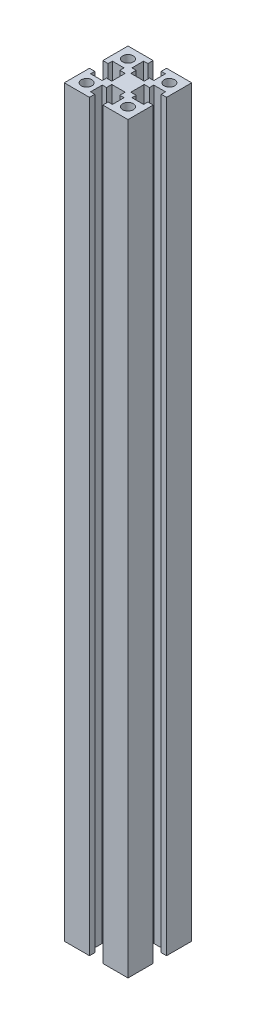
from build123d import *

# Parameters (mm, degrees)
SKETCH_1_R          = 2.5
EXTRUDE_1_DEPTH     = 180
SKETCH_2_R          = 82.250528809
CUT_EXTRUDE_1_DEPTH = 10


with BuildPart() as part:
    # 草图1 → 凸台-拉伸1 (new, symmetric)
    with BuildSketch(Plane(origin=(0, 0, 0), x_dir=(1, 0, 0), z_dir=(0, 1, 0))):
        Polygon((-15, -3.15), (-12.5, -3.15), (-12.5, -5.15), (-7, -5.15), (-7, -3.15), (-4.5, -3.15), (-4.5, 3.15), (-7, 3.15), (-7, 5.15), (-12.5, 5.15), (-12.5, 3.15), (-15, 3.15), (-15, 15), (-3.15, 15), (-3.15, 12.5), (-5.15, 12.5), (-5.15, 7), (-3.15, 7), (-3.15, 4.5), (3.15, 4.5), (3.15, 7), (5.15, 7), (5.15, 12.5), (3.15, 12.5), (3.15, 15), (15, 15), (15, 3.15), (12.5, 3.15), (12.5, 5.15), (7, 5.15), (7, 3.15), (4.5, 3.15), (4.5, -3.15), (7, -3.15), (7, -5.15), (12.5, -5.15), (12.5, -3.15), (15, -3.15), (15, -15), (3.15, -15), (3.15, -12.5), (5.15, -12.5), (5.15, -7), (3.15, -7), (3.15, -4.5), (-3.15, -4.5), (-3.15, -7), (-5.15, -7), (-5.15, -12.5), (-3.15, -12.5), (-3.15, -15), (-15, -15), align=None)
        with Locations(Location((-9.75, -9.75, 0), (0, 0, 90))):
            Circle(SKETCH_1_R, mode=Mode.SUBTRACT)
        with Locations(Location((-9.75, 9.75, 0), (0, 0, 90))):
            Circle(SKETCH_1_R, mode=Mode.SUBTRACT)
        with Locations(Location((9.75, 9.75, 0), (0, 0, 90))):
            Circle(SKETCH_1_R, mode=Mode.SUBTRACT)
        with Locations(Location((9.75, -9.75, 0), (0, 0, 90))):
            Circle(SKETCH_1_R, mode=Mode.SUBTRACT)
    extrude(amount=EXTRUDE_1_DEPTH, both=True)

    # 草图2 → 切除-拉伸1 (cut)
    with BuildSketch(Plane(origin=(0, 180, 0), x_dir=(1, 0, 0), z_dir=(0, 1, 0))):
        Circle(SKETCH_2_R)
    extrude(amount=-CUT_EXTRUDE_1_DEPTH, mode=Mode.SUBTRACT)


solid = part.part
